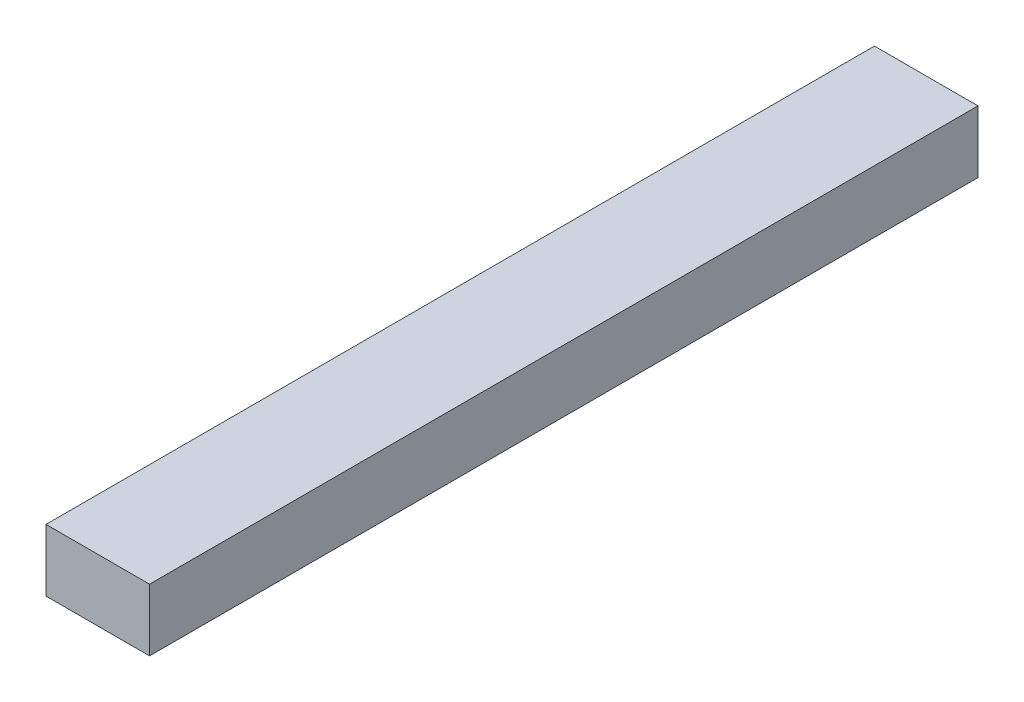
from build123d import *

# Parameters (mm, degrees)
SKIZZE1_W                       = 100
SKIZZE1_H                       = 60
AUFSATZ_LINEAR_AUSTRAGEN1_DEPTH = 400


with BuildPart() as part:
    # Skizze1 → Aufsatz-Linear austragen1 (new, symmetric)
    with BuildSketch(Plane.XY):
        Rectangle(SKIZZE1_W, SKIZZE1_H)
    extrude(amount=AUFSATZ_LINEAR_AUSTRAGEN1_DEPTH, both=True)


solid = part.part
